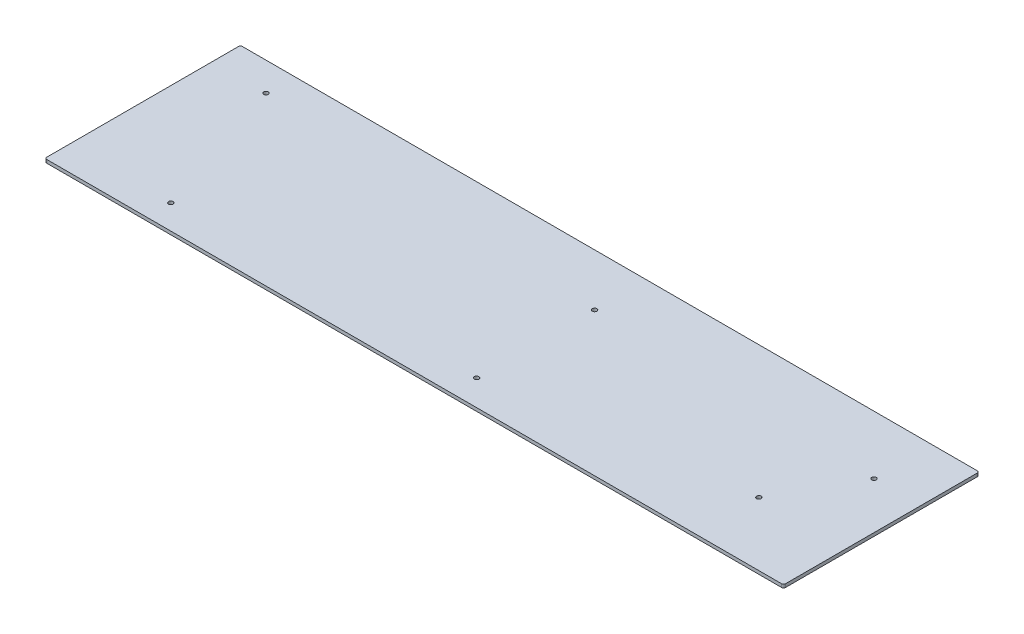
from build123d import *

# Parameters (mm, degrees)
SKETCH1_R           = 1.1
BOSS_EXTRUDE1_DEPTH = 1.6


with BuildPart() as part:
    # Sketch1 → Boss-Extrude1 (new body)
    with BuildSketch(Plane(origin=(0, 0, 0), x_dir=(1, 0, 0), z_dir=(0, 1, 0))):
        with BuildLine():
            Line((-178.825, 47.625), (178.825, 47.625))
            ThreePointArc((178.825, 47.625), (179.532106781, 47.332106781), (179.825, 46.625))
            Line((179.825, 46.625), (179.825, -46.625))
            ThreePointArc((179.825, -46.625), (179.532106781, -47.332106781), (178.825, -47.625))
            Line((178.825, -47.625), (-178.825, -47.625))
            ThreePointArc((-178.825, -47.625), (-179.532106781, -47.332106781), (-179.825, -46.625))
            Line((-179.825, -46.625), (-179.825, 46.625))
            ThreePointArc((-179.825, 46.625), (-179.532106781, 47.332106781), (-178.825, 47.625))
        make_face()
        with Locations(Location((157.075, 19.175, 0), (0, 0, 270))):
            Circle(SKETCH1_R, mode=Mode.SUBTRACT)
        with Locations(Location((136.925, -16.775, 0), (0, 0, 270))):
            Circle(SKETCH1_R, mode=Mode.SUBTRACT)
        with Locations(Location((-153.475, 33.725, 0), (0, 0, 270))):
            Circle(SKETCH1_R, mode=Mode.SUBTRACT)
        with Locations(Location((17.925, 22.275, 0), (0, 0, 270))):
            Circle(SKETCH1_R, mode=Mode.SUBTRACT)
        with Locations(Location((17.875, -35.075, 0), (0, 0, 270))):
            Circle(SKETCH1_R, mode=Mode.SUBTRACT)
        with Locations(Location((-130.375, -35.725, 0), (0, 0, 270))):
            Circle(SKETCH1_R, mode=Mode.SUBTRACT)
    extrude(amount=BOSS_EXTRUDE1_DEPTH)


solid = part.part
